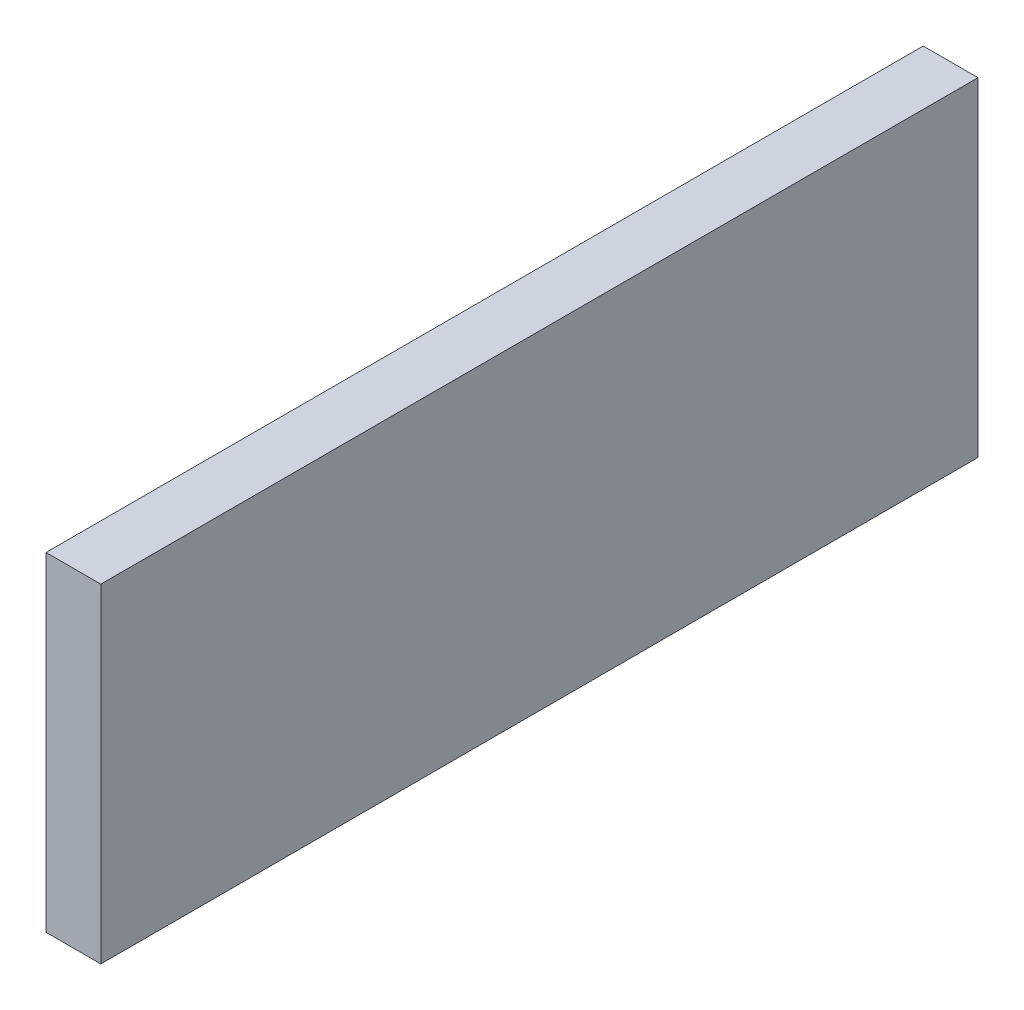
from build123d import *

# Parameters (mm, degrees)
SKETCH1_W           = 30
SKETCH1_H           = 80
BOSS_EXTRUDE1_DEPTH = 5
SKETCH1_3_R         = 4.8
BOSS_EXTRUDE2_DEPTH = 5


with BuildPart() as part:
    # Sketch1 → Boss-Extrude1 (new body)
    with BuildSketch(Plane.YZ):
        Rectangle(SKETCH1_W, SKETCH1_H)
    extrude(amount=BOSS_EXTRUDE1_DEPTH)

    # Sketch1<3> → Boss-Extrude2 (add)
    with BuildSketch(Plane.YZ):
        with Locations((0, 15.35)):
            Circle(SKETCH1_3_R)
        with Locations((0, -15.35)):
            Circle(SKETCH1_3_R)
    extrude(amount=-BOSS_EXTRUDE2_DEPTH)


solid = part.part
